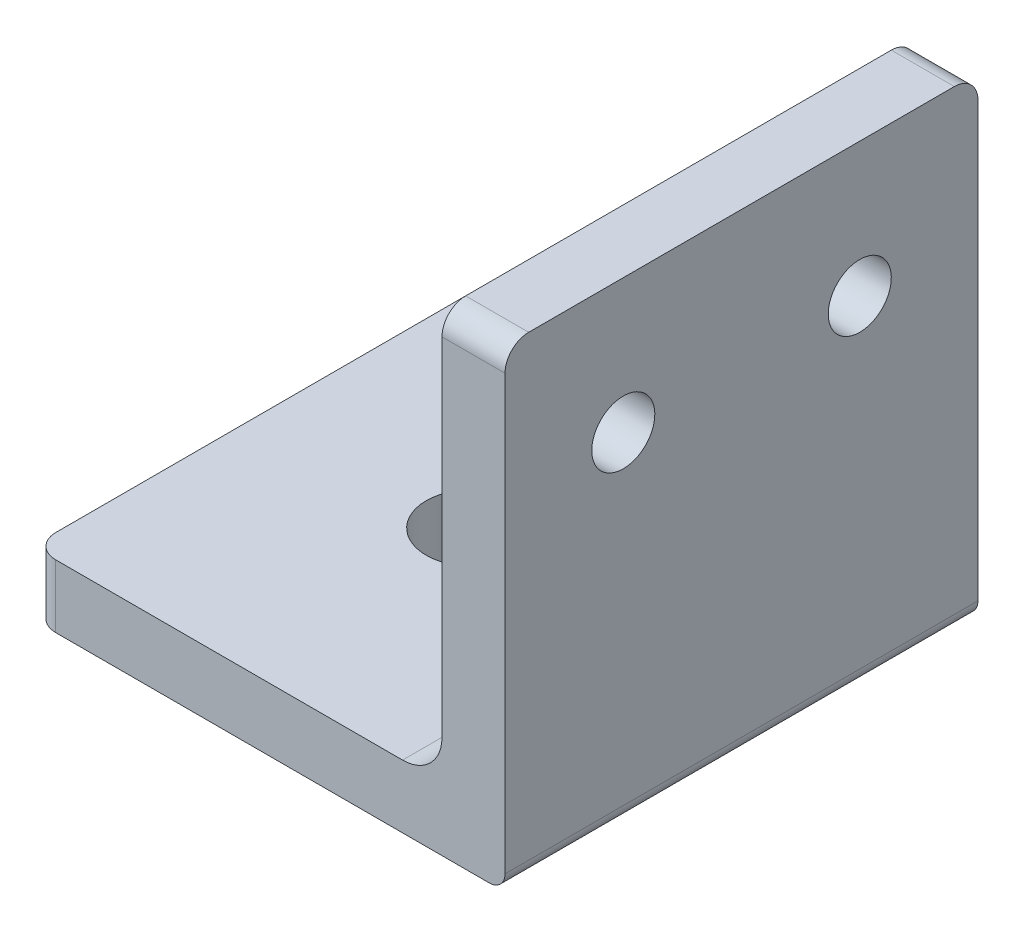
from build123d import *

# Parameters (mm, degrees)
BOSS_EXTRUDE2_DEPTH = 60
SKETCH3_R           = 4
CUT_EXTRUDE1_DEPTH  = 60
SKETCH4_R           = 6
CUT_EXTRUDE2_DEPTH  = 60
FILLET1_R           = 3
FILLET2_R           = 5
FILLET3_R           = 2


with BuildPart() as part:
    # Sketch1 → Boss-Extrude2 (new body)
    with BuildSketch(Plane.XY):
        Polygon((0, 0), (-52, 0), (-52, -8), (8, -8), (8, 52), (0, 52), align=None)
    extrude(amount=BOSS_EXTRUDE2_DEPTH)

    # Sketch3 → Cut-Extrude1 (cut)
    with BuildSketch(Plane.ZY):
        with Locations(Location((15, 35, 0), (0, 0, 270))):
            Circle(SKETCH3_R)
        with Locations(Location((45, 35, 0), (0, 0, 270))):
            Circle(SKETCH3_R)
    extrude(amount=-CUT_EXTRUDE1_DEPTH, mode=Mode.SUBTRACT)

    # Sketch4 → Cut-Extrude2 (cut)
    with BuildSketch(Plane(origin=(0, 0, 0), x_dir=(1, 0, 0), z_dir=(0, 1, 0))):
        with Locations(Location((-26, -30, 0), (0, 0, 180))):
            Circle(SKETCH4_R)
    extrude(amount=-CUT_EXTRUDE2_DEPTH, mode=Mode.SUBTRACT)

    # Fillet1
    fillet1_edges = [part.edges().sort_by_distance(p)[0] for p in [
        (-52, -4, 60),
        (4, 52, 60),
        (4, 52, 0),
        (-52, -4, 0),
    ]]
    fillet(fillet1_edges, radius=FILLET1_R)

    # Fillet2
    fillet2_edges = [part.edges().sort_by_distance(p)[0] for p in [
        (0, 0, 30),
    ]]
    fillet(fillet2_edges, radius=FILLET2_R)

    # Fillet3
    fillet3_edges = [part.edges().sort_by_distance(p)[0] for p in [
        (8, -8, 30),
    ]]
    fillet(fillet3_edges, radius=FILLET3_R)


solid = part.part
